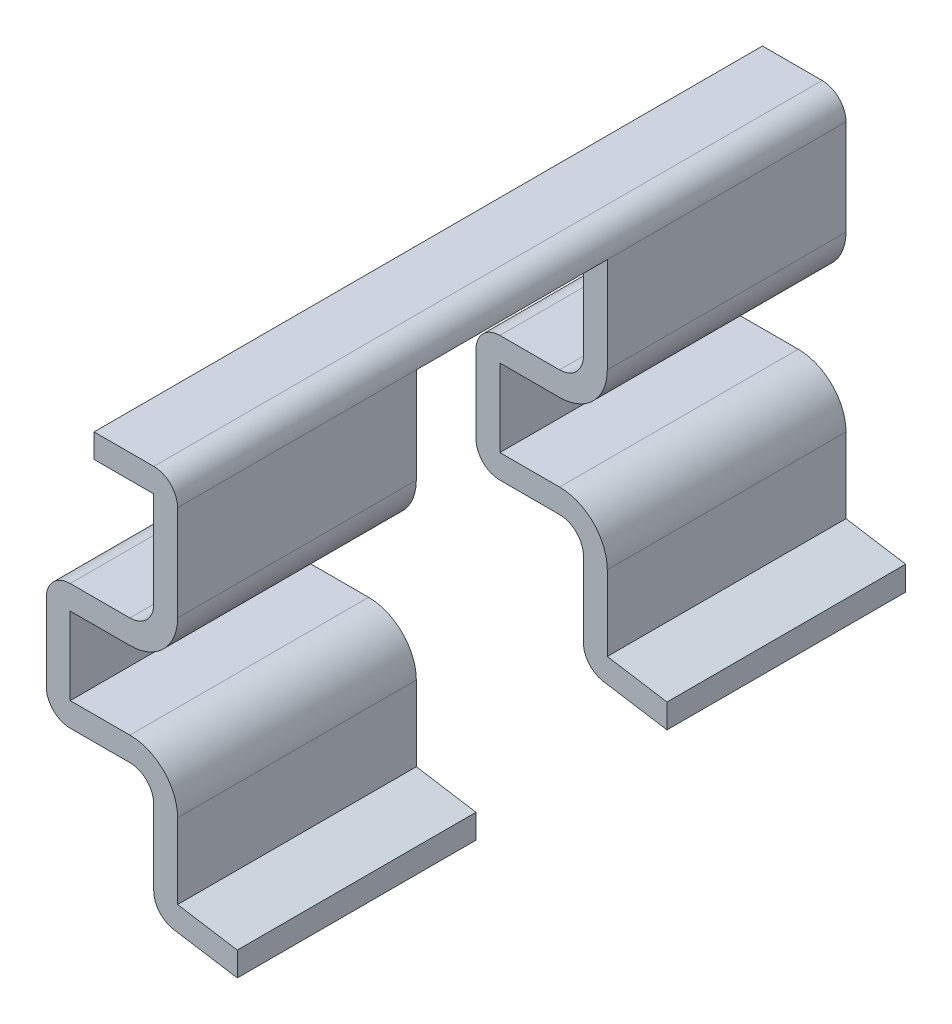
from build123d import *

# Parameters (mm, degrees)
BOSS_EXTRUDE1_DEPTH = 56
SKETCH3_W           = 16
SKETCH3_H           = 36.624213763
CUT_EXTRUDE1_DEPTH  = 62.025698964
FILLET1_R           = 2


with BuildPart() as part:
    # Sketch2 → Boss-Extrude1 (new body)
    with BuildSketch(Plane.XY):
        with BuildLine():
            ThreePointArc((-48.370168415, 13.39961681), (-48.955954852, 14.813830372), (-50.370168415, 15.39961681))
            Line((-50.370168415, 15.39961681), (-55.370168415, 15.39961681))
            Line((-55.370168415, 15.39961681), (-55.370168415, 13.39961681))
            Line((-55.370168415, 13.39961681), (-50.370168415, 13.39961681))
            Line((-50.370168415, 13.39961681), (-50.370168415, 5.39961681))
            ThreePointArc((-50.370168415, 5.39961681), (-50.955954852, 3.985403248), (-52.370168415, 3.39961681))
            Line((-52.370168415, 3.39961681), (-57.370168415, 3.39961681))
            ThreePointArc((-57.370168415, 3.39961681), (-58.784381977, 2.813830372), (-59.370168415, 1.39961681))
            Line((-59.370168415, 1.39961681), (-59.370168415, -5.10038319))
            ThreePointArc((-59.370168415, -5.10038319), (-58.784381977, -6.514596752), (-57.370168415, -7.10038319))
            Line((-57.370168415, -7.10038319), (-52.370168415, -7.10038319))
            ThreePointArc((-52.370168415, -7.10038319), (-50.955954852, -7.686169628), (-50.370168415, -9.10038319))
            Line((-50.370168415, -9.10038319), (-50.370168415, -17.10038319))
            Line((-50.370168415, -17.10038319), (-43.370168415, -18.224596953))
            Line((-43.370168415, -18.224596953), (-43.370168415, -16.19896817))
            Line((-43.370168415, -16.19896817), (-48.370168415, -15.395958339))
            Line((-48.370168415, -15.395958339), (-48.370168415, -9.10038319))
            ThreePointArc((-48.370168415, -9.10038319), (-49.54174129, -6.271956065), (-52.370168415, -5.10038319))
            Line((-52.370168415, -5.10038319), (-57.370168415, -5.10038319))
            Line((-57.370168415, -5.10038319), (-57.370168415, 1.39961681))
            Line((-57.370168415, 1.39961681), (-52.370168415, 1.39961681))
            ThreePointArc((-52.370168415, 1.39961681), (-49.54174129, 2.571189685), (-48.370168415, 5.39961681))
            Line((-48.370168415, 5.39961681), (-48.370168415, 13.39961681))
        make_face()
    extrude(amount=BOSS_EXTRUDE1_DEPTH)

    # Sketch3 → Cut-Extrude1 (cut, through all)
    with BuildSketch(Plane.ZY.offset(59.370168415)):
        with Locations((28, -4.912490072)):
            Rectangle(SKETCH3_W, SKETCH3_H)
    extrude(amount=-CUT_EXTRUDE1_DEPTH, mode=Mode.SUBTRACT)

    # Fillet1
    fillet1_edges = [part.edges().sort_by_distance(p)[0] for p in [
        (-50.370168415, -17.10038319, 10),
        (-50.370168415, -17.10038319, 46),
    ]]
    fillet(fillet1_edges, radius=FILLET1_R)


solid = part.part
